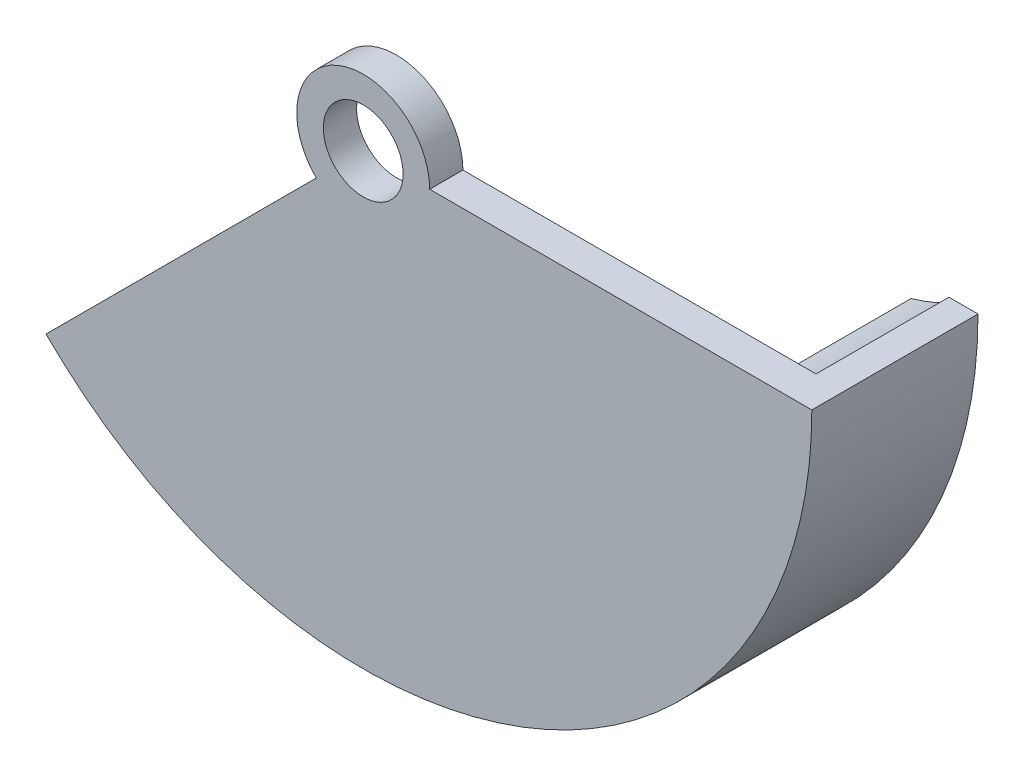
from build123d import *

# Parameters (mm, degrees)
SKETCH4_R           = 67.5
BOSS_EXTRUDE1_DEPTH = 50
CUT_EXTRUDE2_DEPTH  = 250
BOSS_EXTRUDE2_DEPTH = 5
SKETCH7_R           = 6
CUT_EXTRUDE3_DEPTH  = 5
SKETCH8_R           = 10
SKETCH8_R_2         = 6
BOSS_EXTRUDE3_DEPTH = 5
CUT_EXTRUDE5_DEPTH  = 30


with BuildPart() as part:
    # Sketch4 → Boss-Extrude1 (new body)
    with BuildSketch(Plane.XY):
        Circle(SKETCH4_R)
        with BuildLine():
            ThreePointArc((11.932101608, 56.248332875), (11.217693516, 56.395153623), (10.501480633, 56.53290108))
            ThreePointArc((10.501480633, 56.53290108), (9.892570679, 59.547679882), (8.978186327, 62.484270391))
            ThreePointArc((8.978186327, 62.484270391), (8.23959641, 62.585948319), (7.49985715, 62.678896119))
            ThreePointArc((7.49985715, 62.678896119), (5.856584138, 60.079027591), (4.488140116, 57.324572378))
            ThreePointArc((4.488140116, 57.324572378), (3.760679931, 57.376888086), (3.032614698, 57.419972554))
            ThreePointArc((3.032614698, 57.419972554), (2.035406455, 60.329480808), (0.74554281, 63.12159727))
            ThreePointArc((0.74554281, 63.12159727), (0, 63.126), (-0.74554281, 63.12159727))
            ThreePointArc((-0.74554281, 63.12159727), (-2.035406455, 60.329480808), (-3.032614698, 57.419972554))
            ThreePointArc((-3.032614698, 57.419972554), (-3.760679931, 57.376888086), (-4.488140116, 57.324572378))
            ThreePointArc((-4.488140116, 57.324572378), (-5.856584138, 60.079027591), (-7.49985715, 62.678896119))
            ThreePointArc((-7.49985715, 62.678896119), (-8.23959641, 62.585948319), (-8.978186327, 62.484270391))
            ThreePointArc((-8.978186327, 62.484270391), (-9.892570679, 59.547679882), (-10.501480633, 56.53290108))
            ThreePointArc((-10.501480633, 56.53290108), (-11.217693516, 56.395153623), (-11.932101608, 56.248332875))
            ThreePointArc((-11.932101608, 56.248332875), (-13.648366952, 58.800605554), (-15.616932476, 61.163741678))
            ThreePointArc((-15.616932476, 61.163741678), (-16.338211041, 60.97503371), (-17.057210586, 60.777820322))
            ThreePointArc((-17.057210586, 60.777820322), (-17.580470276, 57.747001644), (-17.790663324, 54.678535994))
            ThreePointArc((-17.790663324, 54.678535994), (-18.482769255, 54.448482446), (-19.171901534, 54.209668802))
            ThreePointArc((-19.171901534, 54.209668802), (-21.206622424, 56.516088854), (-23.466797757, 58.602058659))
            ThreePointArc((-23.466797757, 58.602058659), (-24.157274351, 58.320819369), (-24.844381243, 58.031444896))
            ThreePointArc((-24.844381243, 58.031444896), (-24.967563153, 54.958256197), (-24.775442833, 51.888605998))
            ThreePointArc((-24.775442833, 51.888605998), (-25.431599688, 51.570182638), (-26.083664909, 51.243462265))
            ThreePointArc((-26.083664909, 51.243462265), (-28.402026707, 53.264566205), (-30.915139622, 55.037678168))
            ThreePointArc((-30.915139622, 55.037678168), (-31.563, 54.668719639), (-32.206457648, 54.292135358))
            ThreePointArc((-32.206457648, 54.292135358), (-31.927454101, 51.229159749), (-31.336307645, 48.210847567))
            ThreePointArc((-31.336307645, 48.210847567), (-31.945288399, 47.809502707), (-32.549129545, 47.400465882))
            ThreePointArc((-32.549129545, 47.400465882), (-35.111464438, 49.101672059), (-37.834514877, 50.531587745))
            ThreePointArc((-37.834514877, 50.531587745), (-38.428673968, 50.081222959), (-39.017472634, 49.623872332))
            ThreePointArc((-39.017472634, 49.623872332), (-38.341057458, 46.623518175), (-37.360999546, 43.708188168))
            ThreePointArc((-37.360999546, 43.708188168), (-37.912384368, 43.23078893), (-38.457669551, 42.746434386))
            ThreePointArc((-38.457669551, 42.746434386), (-41.220135278, 44.098634692), (-44.106531092, 45.160887846))
            ThreePointArc((-44.106531092, 45.160887846), (-44.636822669, 44.636822669), (-45.160887846, 44.106531092))
            ThreePointArc((-45.160887846, 44.106531092), (-44.098634692, 41.220135278), (-42.746434386, 38.457669551))
            ThreePointArc((-42.746434386, 38.457669551), (-43.23078893, 37.912384368), (-43.708188168, 37.360999546))
            ThreePointArc((-43.708188168, 37.360999546), (-46.623518175, 38.341057458), (-49.623872332, 39.017472634))
            ThreePointArc((-49.623872332, 39.017472634), (-50.081222959, 38.428673968), (-50.531587745, 37.834514877))
            ThreePointArc((-50.531587745, 37.834514877), (-49.101672059, 35.111464438), (-47.400465882, 32.549129545))
            ThreePointArc((-47.400465882, 32.549129545), (-47.809502707, 31.945288399), (-48.210847567, 31.336307645))
            ThreePointArc((-48.210847567, 31.336307645), (-51.229159749, 31.927454101), (-54.292135358, 32.206457648))
            ThreePointArc((-54.292135358, 32.206457648), (-54.668719639, 31.563), (-55.037678168, 30.915139622))
            ThreePointArc((-55.037678168, 30.915139622), (-53.264566205, 28.402026707), (-51.243462265, 26.083664909))
            ThreePointArc((-51.243462265, 26.083664909), (-51.570182638, 25.431599688), (-51.888605998, 24.775442833))
            ThreePointArc((-51.888605998, 24.775442833), (-54.958256197, 24.967563153), (-58.031444896, 24.844381243))
            ThreePointArc((-58.031444896, 24.844381243), (-58.320819369, 24.157274351), (-58.602058659, 23.466797757))
            ThreePointArc((-58.602058659, 23.466797757), (-56.516088854, 21.206622424), (-54.209668802, 19.171901534))
            ThreePointArc((-54.209668802, 19.171901534), (-54.448482446, 18.482769255), (-54.678535994, 17.790663324))
            ThreePointArc((-54.678535994, 17.790663324), (-57.747001644, 17.580470276), (-60.777820322, 17.057210586))
            ThreePointArc((-60.777820322, 17.057210586), (-60.97503371, 16.338211041), (-61.163741678, 15.616932476))
            ThreePointArc((-61.163741678, 15.616932476), (-58.800605554, 13.648366952), (-56.248332875, 11.932101608))
            ThreePointArc((-56.248332875, 11.932101608), (-56.395153623, 11.217693516), (-56.53290108, 10.501480633))
            ThreePointArc((-56.53290108, 10.501480633), (-59.547679882, 9.892570679), (-62.484270391, 8.978186327))
            ThreePointArc((-62.484270391, 8.978186327), (-62.585948319, 8.23959641), (-62.678896119, 7.49985715))
            ThreePointArc((-62.678896119, 7.49985715), (-60.079027591, 5.856584138), (-57.324572378, 4.488140116))
            ThreePointArc((-57.324572378, 4.488140116), (-57.376888086, 3.760679931), (-57.419972554, 3.032614698))
            ThreePointArc((-57.419972554, 3.032614698), (-60.329480808, 2.035406455), (-63.12159727, 0.74554281))
            ThreePointArc((-63.12159727, 0.74554281), (-63.126, 0), (-63.12159727, -0.74554281))
            ThreePointArc((-63.12159727, -0.74554281), (-60.329480808, -2.035406455), (-57.419972554, -3.032614698))
            ThreePointArc((-57.419972554, -3.032614698), (-57.376888086, -3.760679931), (-57.324572378, -4.488140116))
            ThreePointArc((-57.324572378, -4.488140116), (-60.079027591, -5.856584138), (-62.678896119, -7.49985715))
            ThreePointArc((-62.678896119, -7.49985715), (-62.585948319, -8.23959641), (-62.484270391, -8.978186327))
            ThreePointArc((-62.484270391, -8.978186327), (-59.547679882, -9.892570679), (-56.53290108, -10.501480633))
            ThreePointArc((-56.53290108, -10.501480633), (-56.395153623, -11.217693516), (-56.248332875, -11.932101608))
            ThreePointArc((-56.248332875, -11.932101608), (-58.800605554, -13.648366952), (-61.163741678, -15.616932476))
            ThreePointArc((-61.163741678, -15.616932476), (-60.97503371, -16.338211041), (-60.777820322, -17.057210586))
            ThreePointArc((-60.777820322, -17.057210586), (-57.747001644, -17.580470276), (-54.678535994, -17.790663324))
            ThreePointArc((-54.678535994, -17.790663324), (-54.448482446, -18.482769255), (-54.209668802, -19.171901534))
            ThreePointArc((-54.209668802, -19.171901534), (-56.516088854, -21.206622424), (-58.602058659, -23.466797757))
            ThreePointArc((-58.602058659, -23.466797757), (-58.320819369, -24.157274351), (-58.031444896, -24.844381243))
            ThreePointArc((-58.031444896, -24.844381243), (-54.958256197, -24.967563153), (-51.888605998, -24.775442833))
            ThreePointArc((-51.888605998, -24.775442833), (-51.570182638, -25.431599688), (-51.243462265, -26.083664909))
            ThreePointArc((-51.243462265, -26.083664909), (-53.264566205, -28.402026707), (-55.037678168, -30.915139622))
            ThreePointArc((-55.037678168, -30.915139622), (-54.668719639, -31.563), (-54.292135358, -32.206457648))
            ThreePointArc((-54.292135358, -32.206457648), (-51.229159749, -31.927454101), (-48.210847567, -31.336307645))
            ThreePointArc((-48.210847567, -31.336307645), (-47.809502707, -31.945288399), (-47.400465882, -32.549129545))
            ThreePointArc((-47.400465882, -32.549129545), (-49.101672059, -35.111464438), (-50.531587745, -37.834514877))
            ThreePointArc((-50.531587745, -37.834514877), (-50.081222959, -38.428673968), (-49.623872332, -39.017472634))
            ThreePointArc((-49.623872332, -39.017472634), (-46.623518175, -38.341057458), (-43.708188168, -37.360999546))
            ThreePointArc((-43.708188168, -37.360999546), (-43.23078893, -37.912384368), (-42.746434386, -38.457669551))
            ThreePointArc((-42.746434386, -38.457669551), (-44.098634692, -41.220135278), (-45.160887846, -44.106531092))
            ThreePointArc((-45.160887846, -44.106531092), (-44.636822669, -44.636822669), (-44.106531092, -45.160887846))
            ThreePointArc((-44.106531092, -45.160887846), (-41.220135278, -44.098634692), (-38.457669551, -42.746434386))
            ThreePointArc((-38.457669551, -42.746434386), (-37.912384368, -43.23078893), (-37.360999546, -43.708188168))
            ThreePointArc((-37.360999546, -43.708188168), (-38.341057458, -46.623518175), (-39.017472634, -49.623872332))
            ThreePointArc((-39.017472634, -49.623872332), (-38.428673968, -50.081222959), (-37.834514877, -50.531587745))
            ThreePointArc((-37.834514877, -50.531587745), (-35.111464438, -49.101672059), (-32.549129545, -47.400465882))
            ThreePointArc((-32.549129545, -47.400465882), (-31.945288399, -47.809502707), (-31.336307645, -48.210847567))
            ThreePointArc((-31.336307645, -48.210847567), (-31.927454101, -51.229159749), (-32.206457648, -54.292135358))
            ThreePointArc((-32.206457648, -54.292135358), (-31.563, -54.668719639), (-30.915139622, -55.037678168))
            ThreePointArc((-30.915139622, -55.037678168), (-28.402026707, -53.264566205), (-26.083664909, -51.243462265))
            ThreePointArc((-26.083664909, -51.243462265), (-25.431599688, -51.570182638), (-24.775442833, -51.888605998))
            ThreePointArc((-24.775442833, -51.888605998), (-24.967563153, -54.958256197), (-24.844381243, -58.031444896))
            ThreePointArc((-24.844381243, -58.031444896), (-24.157274351, -58.320819369), (-23.466797757, -58.602058659))
            ThreePointArc((-23.466797757, -58.602058659), (-21.206622424, -56.516088854), (-19.171901534, -54.209668802))
            ThreePointArc((-19.171901534, -54.209668802), (-18.482769255, -54.448482446), (-17.790663324, -54.678535994))
            ThreePointArc((-17.790663324, -54.678535994), (-17.580470276, -57.747001644), (-17.057210586, -60.777820322))
            ThreePointArc((-17.057210586, -60.777820322), (-16.338211041, -60.97503371), (-15.616932476, -61.163741678))
            ThreePointArc((-15.616932476, -61.163741678), (-13.648366952, -58.800605554), (-11.932101608, -56.248332875))
            ThreePointArc((-11.932101608, -56.248332875), (-11.217693516, -56.395153623), (-10.501480633, -56.53290108))
            ThreePointArc((-10.501480633, -56.53290108), (-9.892570679, -59.547679882), (-8.978186327, -62.484270391))
            ThreePointArc((-8.978186327, -62.484270391), (-8.23959641, -62.585948319), (-7.49985715, -62.678896119))
            ThreePointArc((-7.49985715, -62.678896119), (-5.856584138, -60.079027591), (-4.488140116, -57.324572378))
            ThreePointArc((-4.488140116, -57.324572378), (-3.760679931, -57.376888086), (-3.032614698, -57.419972554))
            ThreePointArc((-3.032614698, -57.419972554), (-2.035406455, -60.329480808), (-0.74554281, -63.12159727))
            ThreePointArc((-0.74554281, -63.12159727), (0, -63.126), (0.74554281, -63.12159727))
            ThreePointArc((0.74554281, -63.12159727), (2.035406455, -60.329480808), (3.032614698, -57.419972554))
            ThreePointArc((3.032614698, -57.419972554), (3.760679931, -57.376888086), (4.488140116, -57.324572378))
            ThreePointArc((4.488140116, -57.324572378), (5.856584138, -60.079027591), (7.49985715, -62.678896119))
            ThreePointArc((7.49985715, -62.678896119), (8.23959641, -62.585948319), (8.978186327, -62.484270391))
            ThreePointArc((8.978186327, -62.484270391), (9.892570679, -59.547679882), (10.501480633, -56.53290108))
            ThreePointArc((10.501480633, -56.53290108), (11.217693516, -56.395153623), (11.932101608, -56.248332875))
            ThreePointArc((11.932101608, -56.248332875), (13.648366952, -58.800605554), (15.616932476, -61.163741678))
            ThreePointArc((15.616932476, -61.163741678), (16.338211041, -60.97503371), (17.057210586, -60.777820322))
            ThreePointArc((17.057210586, -60.777820322), (17.580470276, -57.747001644), (17.790663324, -54.678535994))
            ThreePointArc((17.790663324, -54.678535994), (18.482769255, -54.448482446), (19.171901534, -54.209668802))
            ThreePointArc((19.171901534, -54.209668802), (21.206622424, -56.516088854), (23.466797757, -58.602058659))
            ThreePointArc((23.466797757, -58.602058659), (24.157274351, -58.320819369), (24.844381243, -58.031444896))
            ThreePointArc((24.844381243, -58.031444896), (24.967563153, -54.958256197), (24.775442833, -51.888605998))
            ThreePointArc((24.775442833, -51.888605998), (25.431599688, -51.570182638), (26.083664909, -51.243462265))
            ThreePointArc((26.083664909, -51.243462265), (28.402026707, -53.264566205), (30.915139622, -55.037678168))
            ThreePointArc((30.915139622, -55.037678168), (31.563, -54.668719639), (32.206457648, -54.292135358))
            ThreePointArc((32.206457648, -54.292135358), (31.927454101, -51.229159749), (31.336307645, -48.210847567))
            ThreePointArc((31.336307645, -48.210847567), (31.945288399, -47.809502707), (32.549129545, -47.400465882))
            ThreePointArc((32.549129545, -47.400465882), (35.111464438, -49.101672059), (37.834514877, -50.531587745))
            ThreePointArc((37.834514877, -50.531587745), (38.428673968, -50.081222959), (39.017472634, -49.623872332))
            ThreePointArc((39.017472634, -49.623872332), (38.341057458, -46.623518175), (37.360999546, -43.708188168))
            ThreePointArc((37.360999546, -43.708188168), (37.912384368, -43.23078893), (38.457669551, -42.746434386))
            ThreePointArc((38.457669551, -42.746434386), (41.220135278, -44.098634692), (44.106531092, -45.160887846))
            ThreePointArc((44.106531092, -45.160887846), (44.636822669, -44.636822669), (45.160887846, -44.106531092))
            ThreePointArc((45.160887846, -44.106531092), (44.098634692, -41.220135278), (42.746434386, -38.457669551))
            ThreePointArc((42.746434386, -38.457669551), (43.23078893, -37.912384368), (43.708188168, -37.360999546))
            ThreePointArc((43.708188168, -37.360999546), (46.623518175, -38.341057458), (49.623872332, -39.017472634))
            ThreePointArc((49.623872332, -39.017472634), (50.081222959, -38.428673968), (50.531587745, -37.834514877))
            ThreePointArc((50.531587745, -37.834514877), (49.101672059, -35.111464438), (47.400465882, -32.549129545))
            ThreePointArc((47.400465882, -32.549129545), (47.809502707, -31.945288399), (48.210847567, -31.336307645))
            ThreePointArc((48.210847567, -31.336307645), (51.229159749, -31.927454101), (54.292135358, -32.206457648))
            ThreePointArc((54.292135358, -32.206457648), (54.668719639, -31.563), (55.037678168, -30.915139622))
            ThreePointArc((55.037678168, -30.915139622), (53.264566205, -28.402026707), (51.243462265, -26.083664909))
            ThreePointArc((51.243462265, -26.083664909), (51.570182638, -25.431599688), (51.888605998, -24.775442833))
            ThreePointArc((51.888605998, -24.775442833), (54.958256197, -24.967563153), (58.031444896, -24.844381243))
            ThreePointArc((58.031444896, -24.844381243), (58.320819369, -24.157274351), (58.602058659, -23.466797757))
            ThreePointArc((58.602058659, -23.466797757), (56.516088854, -21.206622424), (54.209668802, -19.171901534))
            ThreePointArc((54.209668802, -19.171901534), (54.448482446, -18.482769255), (54.678535994, -17.790663324))
            ThreePointArc((54.678535994, -17.790663324), (57.747001644, -17.580470276), (60.777820322, -17.057210586))
            ThreePointArc((60.777820322, -17.057210586), (60.97503371, -16.338211041), (61.163741678, -15.616932476))
            ThreePointArc((61.163741678, -15.616932476), (58.800605554, -13.648366952), (56.248332875, -11.932101608))
            ThreePointArc((56.248332875, -11.932101608), (56.395153623, -11.217693516), (56.53290108, -10.501480633))
            ThreePointArc((56.53290108, -10.501480633), (59.547679882, -9.892570679), (62.484270391, -8.978186327))
            ThreePointArc((62.484270391, -8.978186327), (62.585948319, -8.23959641), (62.678896119, -7.49985715))
            ThreePointArc((62.678896119, -7.49985715), (60.079027591, -5.856584138), (57.324572378, -4.488140116))
            ThreePointArc((57.324572378, -4.488140116), (57.376888086, -3.760679931), (57.419972554, -3.032614698))
            ThreePointArc((57.419972554, -3.032614698), (60.329480808, -2.035406455), (63.12159727, -0.74554281))
            ThreePointArc((63.12159727, -0.74554281), (63.126, 0), (63.12159727, 0.74554281))
            ThreePointArc((63.12159727, 0.74554281), (60.329480808, 2.035406455), (57.419972554, 3.032614698))
            ThreePointArc((57.419972554, 3.032614698), (57.376888086, 3.760679931), (57.324572378, 4.488140116))
            ThreePointArc((57.324572378, 4.488140116), (60.079027591, 5.856584138), (62.678896119, 7.49985715))
            ThreePointArc((62.678896119, 7.49985715), (62.585948319, 8.23959641), (62.484270391, 8.978186327))
            ThreePointArc((62.484270391, 8.978186327), (59.547679882, 9.892570679), (56.53290108, 10.501480633))
            ThreePointArc((56.53290108, 10.501480633), (56.395153623, 11.217693516), (56.248332875, 11.932101608))
            ThreePointArc((56.248332875, 11.932101608), (58.800605554, 13.648366952), (61.163741678, 15.616932476))
            ThreePointArc((61.163741678, 15.616932476), (60.97503371, 16.338211041), (60.777820322, 17.057210586))
            ThreePointArc((60.777820322, 17.057210586), (57.747001644, 17.580470276), (54.678535994, 17.790663324))
            ThreePointArc((54.678535994, 17.790663324), (54.448482446, 18.482769255), (54.209668802, 19.171901534))
            ThreePointArc((54.209668802, 19.171901534), (56.516088854, 21.206622424), (58.602058659, 23.466797757))
            ThreePointArc((58.602058659, 23.466797757), (58.320819369, 24.157274351), (58.031444896, 24.844381243))
            ThreePointArc((58.031444896, 24.844381243), (54.958256197, 24.967563153), (51.888605998, 24.775442833))
            ThreePointArc((51.888605998, 24.775442833), (51.570182638, 25.431599688), (51.243462265, 26.083664909))
            ThreePointArc((51.243462265, 26.083664909), (53.264566205, 28.402026707), (55.037678168, 30.915139622))
            ThreePointArc((55.037678168, 30.915139622), (54.668719639, 31.563), (54.292135358, 32.206457648))
            ThreePointArc((54.292135358, 32.206457648), (51.229159749, 31.927454101), (48.210847567, 31.336307645))
            ThreePointArc((48.210847567, 31.336307645), (47.809502707, 31.945288399), (47.400465882, 32.549129545))
            ThreePointArc((47.400465882, 32.549129545), (49.101672059, 35.111464438), (50.531587745, 37.834514877))
            ThreePointArc((50.531587745, 37.834514877), (50.081222959, 38.428673968), (49.623872332, 39.017472634))
            ThreePointArc((49.623872332, 39.017472634), (46.623518175, 38.341057458), (43.708188168, 37.360999546))
            ThreePointArc((43.708188168, 37.360999546), (43.23078893, 37.912384368), (42.746434386, 38.457669551))
            ThreePointArc((42.746434386, 38.457669551), (44.098634692, 41.220135278), (45.160887846, 44.106531092))
            ThreePointArc((45.160887846, 44.106531092), (44.636822669, 44.636822669), (44.106531092, 45.160887846))
            ThreePointArc((44.106531092, 45.160887846), (41.220135278, 44.098634692), (38.457669551, 42.746434386))
            ThreePointArc((38.457669551, 42.746434386), (37.912384368, 43.23078893), (37.360999546, 43.708188168))
            ThreePointArc((37.360999546, 43.708188168), (38.341057458, 46.623518175), (39.017472634, 49.623872332))
            ThreePointArc((39.017472634, 49.623872332), (38.428673968, 50.081222959), (37.834514877, 50.531587745))
            ThreePointArc((37.834514877, 50.531587745), (35.111464438, 49.101672059), (32.549129545, 47.400465882))
            ThreePointArc((32.549129545, 47.400465882), (31.945288399, 47.809502707), (31.336307645, 48.210847567))
            ThreePointArc((31.336307645, 48.210847567), (31.927454101, 51.229159749), (32.206457648, 54.292135358))
            ThreePointArc((32.206457648, 54.292135358), (31.563, 54.668719639), (30.915139622, 55.037678168))
            ThreePointArc((30.915139622, 55.037678168), (28.402026707, 53.264566205), (26.083664909, 51.243462265))
            ThreePointArc((26.083664909, 51.243462265), (25.431599688, 51.570182638), (24.775442833, 51.888605998))
            ThreePointArc((24.775442833, 51.888605998), (24.967563153, 54.958256197), (24.844381243, 58.031444896))
            ThreePointArc((24.844381243, 58.031444896), (24.157274351, 58.320819369), (23.466797757, 58.602058659))
            ThreePointArc((23.466797757, 58.602058659), (21.206622424, 56.516088854), (19.171901534, 54.209668802))
            ThreePointArc((19.171901534, 54.209668802), (18.482769255, 54.448482446), (17.790663324, 54.678535994))
            ThreePointArc((17.790663324, 54.678535994), (17.580470276, 57.747001644), (17.057210586, 60.777820322))
            ThreePointArc((17.057210586, 60.777820322), (16.338211041, 60.97503371), (15.616932476, 61.163741678))
            ThreePointArc((15.616932476, 61.163741678), (13.648366952, 58.800605554), (11.932101608, 56.248332875))
        make_face(mode=Mode.SUBTRACT)
    extrude(amount=BOSS_EXTRUDE1_DEPTH)

    # Sketch5 → Cut-Extrude2 (cut)
    with BuildSketch(Plane(origin=(0, 0, 0), x_dir=(-1, 0, 0), z_dir=(0, 0, -1))):
        with BuildLine():
            Line((0, 0), (47.72970773, -47.72970773))
            ThreePointArc((47.72970773, -47.72970773), (25.831131685, 62.361868445), (-67.5, 0))
            Line((-67.5, 0), (0, 0))
        make_face()
    extrude(amount=-CUT_EXTRUDE2_DEPTH, mode=Mode.SUBTRACT)

    # Sketch6 → Boss-Extrude2 (add)
    with BuildSketch(Plane.XY.offset(50)):
        with BuildLine():
            ThreePointArc((67.5, 0), (25.831131685, -62.361868445), (-47.72970773, -47.72970773))
            Line((-47.72970773, -47.72970773), (0, 0))
            Line((0, 0), (67.5, 0))
        make_face()
    extrude(amount=BOSS_EXTRUDE2_DEPTH)

    # Sketch7 → Cut-Extrude3 (cut)
    with BuildSketch(Plane.XY.offset(55)):
        Circle(SKETCH7_R)
    extrude(amount=-CUT_EXTRUDE3_DEPTH, mode=Mode.SUBTRACT)

    # Sketch8 → Boss-Extrude3 (add)
    with BuildSketch(Plane.XY.offset(55)):
        Circle(SKETCH8_R)
        Circle(SKETCH8_R_2, mode=Mode.SUBTRACT)
    extrude(amount=-BOSS_EXTRUDE3_DEPTH)

    # Sketch9 → Cut-Extrude5 (cut)
    with BuildSketch(Plane(origin=(0, 0, 0), x_dir=(-1, 0, 0), z_dir=(0, 0, -1))):
        with BuildLine():
            Line((47.72970773, -47.72970773), (44.636822669, -44.636822669))
            ThreePointArc((44.636822669, -44.636822669), (44.372450578, -44.899638147), (44.106531092, -45.160887846))
            ThreePointArc((44.106531092, -45.160887846), (41.220135278, -44.098634692), (38.457669551, -42.746434386))
            ThreePointArc((38.457669551, -42.746434386), (37.912384368, -43.23078893), (37.360999546, -43.708188168))
            ThreePointArc((37.360999546, -43.708188168), (38.341057458, -46.623518175), (39.017472634, -49.623872332))
            ThreePointArc((39.017472634, -49.623872332), (38.428673968, -50.081222959), (37.834514877, -50.531587745))
            ThreePointArc((37.834514877, -50.531587745), (35.111464438, -49.101672059), (32.549129545, -47.400465882))
            ThreePointArc((32.549129545, -47.400465882), (31.945288399, -47.809502707), (31.336307645, -48.210847567))
            ThreePointArc((31.336307645, -48.210847567), (31.927454101, -51.229159749), (32.206457648, -54.292135358))
            ThreePointArc((32.206457648, -54.292135358), (31.563, -54.668719639), (30.915139622, -55.037678168))
            ThreePointArc((30.915139622, -55.037678168), (28.402026707, -53.264566205), (26.083664909, -51.243462265))
            ThreePointArc((26.083664909, -51.243462265), (25.431599688, -51.570182638), (24.775442833, -51.888605998))
            ThreePointArc((24.775442833, -51.888605998), (24.967563153, -54.958256197), (24.844381243, -58.031444896))
            ThreePointArc((24.844381243, -58.031444896), (24.157274351, -58.320819369), (23.466797757, -58.602058659))
            ThreePointArc((23.466797757, -58.602058659), (21.206622424, -56.516088854), (19.171901534, -54.209668802))
            ThreePointArc((19.171901534, -54.209668802), (18.482769255, -54.448482446), (17.790663324, -54.678535994))
            ThreePointArc((17.790663324, -54.678535994), (17.580470276, -57.747001644), (17.057210586, -60.777820322))
            ThreePointArc((17.057210586, -60.777820322), (16.338211041, -60.97503371), (15.616932476, -61.163741678))
            ThreePointArc((15.616932476, -61.163741678), (13.648366952, -58.800605554), (11.932101608, -56.248332875))
            ThreePointArc((11.932101608, -56.248332875), (11.217693516, -56.395153623), (10.501480633, -56.53290108))
            ThreePointArc((10.501480633, -56.53290108), (9.892570679, -59.547679882), (8.978186327, -62.484270391))
            ThreePointArc((8.978186327, -62.484270391), (8.23959641, -62.585948319), (7.49985715, -62.678896119))
            ThreePointArc((7.49985715, -62.678896119), (5.856584138, -60.079027591), (4.488140116, -57.324572378))
            ThreePointArc((4.488140116, -57.324572378), (3.760679931, -57.376888086), (3.032614698, -57.419972554))
            ThreePointArc((3.032614698, -57.419972554), (2.035406455, -60.329480808), (0.74554281, -63.12159727))
            ThreePointArc((0.74554281, -63.12159727), (0, -63.126), (-0.74554281, -63.12159727))
            ThreePointArc((-0.74554281, -63.12159727), (-2.035406455, -60.329480808), (-3.032614698, -57.419972554))
            ThreePointArc((-3.032614698, -57.419972554), (-3.760679931, -57.376888086), (-4.488140116, -57.324572378))
            ThreePointArc((-4.488140116, -57.324572378), (-5.856584138, -60.079027591), (-7.49985715, -62.678896119))
            ThreePointArc((-7.49985715, -62.678896119), (-8.23959641, -62.585948319), (-8.978186327, -62.484270391))
            ThreePointArc((-8.978186327, -62.484270391), (-9.892570679, -59.547679882), (-10.501480633, -56.53290108))
            ThreePointArc((-10.501480633, -56.53290108), (-11.217693516, -56.395153623), (-11.932101608, -56.248332875))
            ThreePointArc((-11.932101608, -56.248332875), (-13.648366952, -58.800605554), (-15.616932476, -61.163741678))
            ThreePointArc((-15.616932476, -61.163741678), (-16.338211041, -60.97503371), (-17.057210586, -60.777820322))
            ThreePointArc((-17.057210586, -60.777820322), (-17.580470276, -57.747001644), (-17.790663324, -54.678535994))
            ThreePointArc((-17.790663324, -54.678535994), (-18.482769255, -54.448482446), (-19.171901534, -54.209668802))
            ThreePointArc((-19.171901534, -54.209668802), (-21.206622424, -56.516088854), (-23.466797757, -58.602058659))
            ThreePointArc((-23.466797757, -58.602058659), (-24.157274351, -58.320819369), (-24.844381243, -58.031444896))
            ThreePointArc((-24.844381243, -58.031444896), (-24.967563153, -54.958256197), (-24.775442833, -51.888605998))
            ThreePointArc((-24.775442833, -51.888605998), (-25.431599688, -51.570182638), (-26.083664909, -51.243462265))
            ThreePointArc((-26.083664909, -51.243462265), (-28.402026707, -53.264566205), (-30.915139622, -55.037678168))
            ThreePointArc((-30.915139622, -55.037678168), (-31.563, -54.668719639), (-32.206457648, -54.292135358))
            ThreePointArc((-32.206457648, -54.292135358), (-31.927454101, -51.229159749), (-31.336307645, -48.210847567))
            ThreePointArc((-31.336307645, -48.210847567), (-31.945288399, -47.809502707), (-32.549129545, -47.400465882))
            ThreePointArc((-32.549129545, -47.400465882), (-35.111464438, -49.101672059), (-37.834514877, -50.531587745))
            ThreePointArc((-37.834514877, -50.531587745), (-38.428673968, -50.081222959), (-39.017472634, -49.623872332))
            ThreePointArc((-39.017472634, -49.623872332), (-38.341057458, -46.623518175), (-37.360999546, -43.708188168))
            ThreePointArc((-37.360999546, -43.708188168), (-37.912384368, -43.23078893), (-38.457669551, -42.746434386))
            ThreePointArc((-38.457669551, -42.746434386), (-41.220135278, -44.098634692), (-44.106531092, -45.160887846))
            ThreePointArc((-44.106531092, -45.160887846), (-44.636822669, -44.636822669), (-45.160887846, -44.106531092))
            ThreePointArc((-45.160887846, -44.106531092), (-44.098634692, -41.220135278), (-42.746434386, -38.457669551))
            ThreePointArc((-42.746434386, -38.457669551), (-43.23078893, -37.912384368), (-43.708188168, -37.360999546))
            ThreePointArc((-43.708188168, -37.360999546), (-46.623518175, -38.341057458), (-49.623872332, -39.017472634))
            ThreePointArc((-49.623872332, -39.017472634), (-50.081222959, -38.428673968), (-50.531587745, -37.834514877))
            ThreePointArc((-50.531587745, -37.834514877), (-49.101672059, -35.111464438), (-47.400465882, -32.549129545))
            ThreePointArc((-47.400465882, -32.549129545), (-47.809502707, -31.945288399), (-48.210847567, -31.336307645))
            ThreePointArc((-48.210847567, -31.336307645), (-51.229159749, -31.927454101), (-54.292135358, -32.206457648))
            ThreePointArc((-54.292135358, -32.206457648), (-54.668719639, -31.563), (-55.037678168, -30.915139622))
            ThreePointArc((-55.037678168, -30.915139622), (-53.264566205, -28.402026707), (-51.243462265, -26.083664909))
            ThreePointArc((-51.243462265, -26.083664909), (-51.570182638, -25.431599688), (-51.888605998, -24.775442833))
            ThreePointArc((-51.888605998, -24.775442833), (-54.958256197, -24.967563153), (-58.031444896, -24.844381243))
            ThreePointArc((-58.031444896, -24.844381243), (-58.320819369, -24.157274351), (-58.602058659, -23.466797757))
            ThreePointArc((-58.602058659, -23.466797757), (-56.516088854, -21.206622424), (-54.209668802, -19.171901534))
            ThreePointArc((-54.209668802, -19.171901534), (-54.448482446, -18.482769255), (-54.678535994, -17.790663324))
            ThreePointArc((-54.678535994, -17.790663324), (-57.747001644, -17.580470276), (-60.777820322, -17.057210586))
            ThreePointArc((-60.777820322, -17.057210586), (-60.97503371, -16.338211041), (-61.163741678, -15.616932476))
            ThreePointArc((-61.163741678, -15.616932476), (-58.800605554, -13.648366952), (-56.248332875, -11.932101608))
            ThreePointArc((-56.248332875, -11.932101608), (-56.395153623, -11.217693516), (-56.53290108, -10.501480633))
            ThreePointArc((-56.53290108, -10.501480633), (-59.547679882, -9.892570679), (-62.484270391, -8.978186327))
            ThreePointArc((-62.484270391, -8.978186327), (-62.585948319, -8.23959641), (-62.678896119, -7.49985715))
            ThreePointArc((-62.678896119, -7.49985715), (-60.079027591, -5.856584138), (-57.324572378, -4.488140116))
            ThreePointArc((-57.324572378, -4.488140116), (-57.376888086, -3.760679931), (-57.419972554, -3.032614698))
            ThreePointArc((-57.419972554, -3.032614698), (-60.329480808, -2.035406455), (-63.12159727, -0.74554281))
            ThreePointArc((-63.12159727, -0.74554281), (-63.124899308, -0.372777905), (-63.126, 0))
            Line((-63.126, 0), (-67.5, 0))
            ThreePointArc((-67.5, 0), (-25.831131685, -62.361868445), (47.72970773, -47.72970773))
        make_face()
    extrude(amount=-CUT_EXTRUDE5_DEPTH, mode=Mode.SUBTRACT)


solid = part.part
